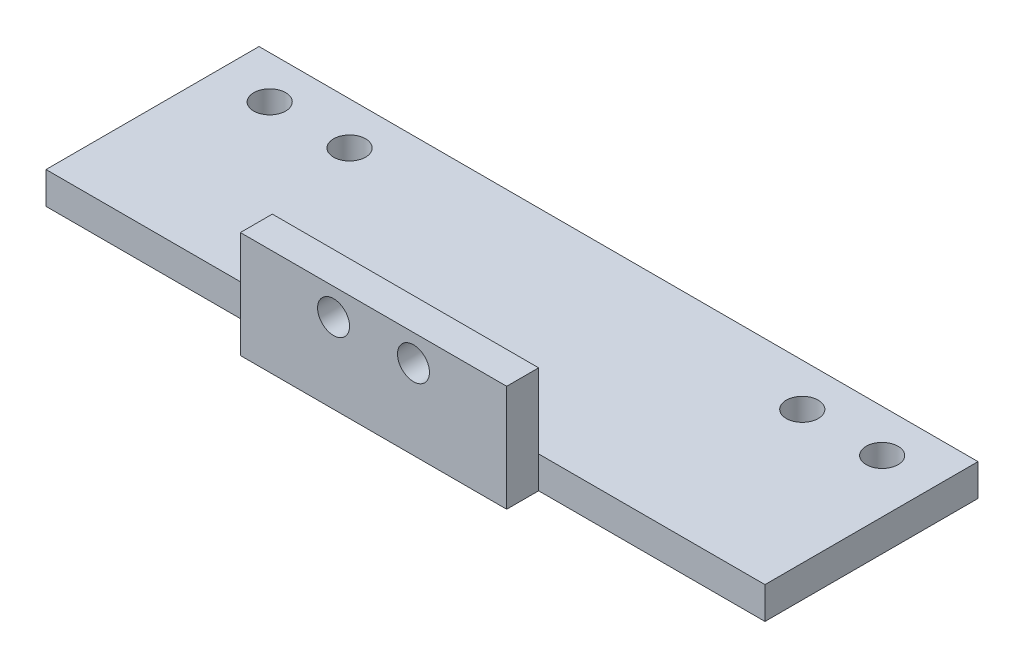
from build123d import *

# Parameters (mm, degrees)
SKETCH1_W           = 50
SKETCH1_H           = 6
BOSS_EXTRUDE1_DEPTH = 20
SKETCH2_R           = 3
CUT_EXTRUDE1_DEPTH  = 33.57299495
SKETCH3_W           = 135
SKETCH3_H           = 6
BOSS_EXTRUDE2_DEPTH = 40
SKETCH4_R           = 3
CUT_EXTRUDE2_DEPTH  = 82.2480769


with BuildPart() as part:
    # Sketch1 → Boss-Extrude1 (new body)
    with BuildSketch(Plane(origin=(0, 0, 0), x_dir=(1, 0, 0), z_dir=(0, 1, 0))):
        Rectangle(SKETCH1_W, SKETCH1_H)
    extrude(amount=BOSS_EXTRUDE1_DEPTH)

    # Sketch2 → Cut-Extrude1 (cut, through all)
    with BuildSketch(Plane(origin=(0, 0, -3), x_dir=(-1, 0, 0), z_dir=(0, 0, -1))):
        with Locations((-7.5, 15)):
            Circle(SKETCH2_R)
        with Locations((7.5, 15)):
            Circle(SKETCH2_R)
    extrude(amount=-CUT_EXTRUDE1_DEPTH, mode=Mode.SUBTRACT)

    # Sketch3 → Boss-Extrude2 (add)
    with BuildSketch(Plane(origin=(0, 0, -3), x_dir=(-1, 0, 0), z_dir=(0, 0, -1))):
        with Locations((0, 3)):
            Rectangle(SKETCH3_W, SKETCH3_H)
    extrude(amount=BOSS_EXTRUDE2_DEPTH)

    # Sketch4 → Cut-Extrude2 (cut, through all)
    with BuildSketch(Plane(origin=(0, 6, 0), x_dir=(1, 0, 0), z_dir=(0, 1, 0))):
        with Locations(Location((-57.5, 35, 0), (0, 0, 180))):
            Circle(SKETCH4_R)
        with Locations(Location((-42.5, 35, 0), (0, 0, 180))):
            Circle(SKETCH4_R)
        with Locations((42.5, 35)):
            Circle(SKETCH4_R)
        with Locations((57.5, 35)):
            Circle(SKETCH4_R)
    extrude(amount=-CUT_EXTRUDE2_DEPTH, mode=Mode.SUBTRACT)


solid = part.part
